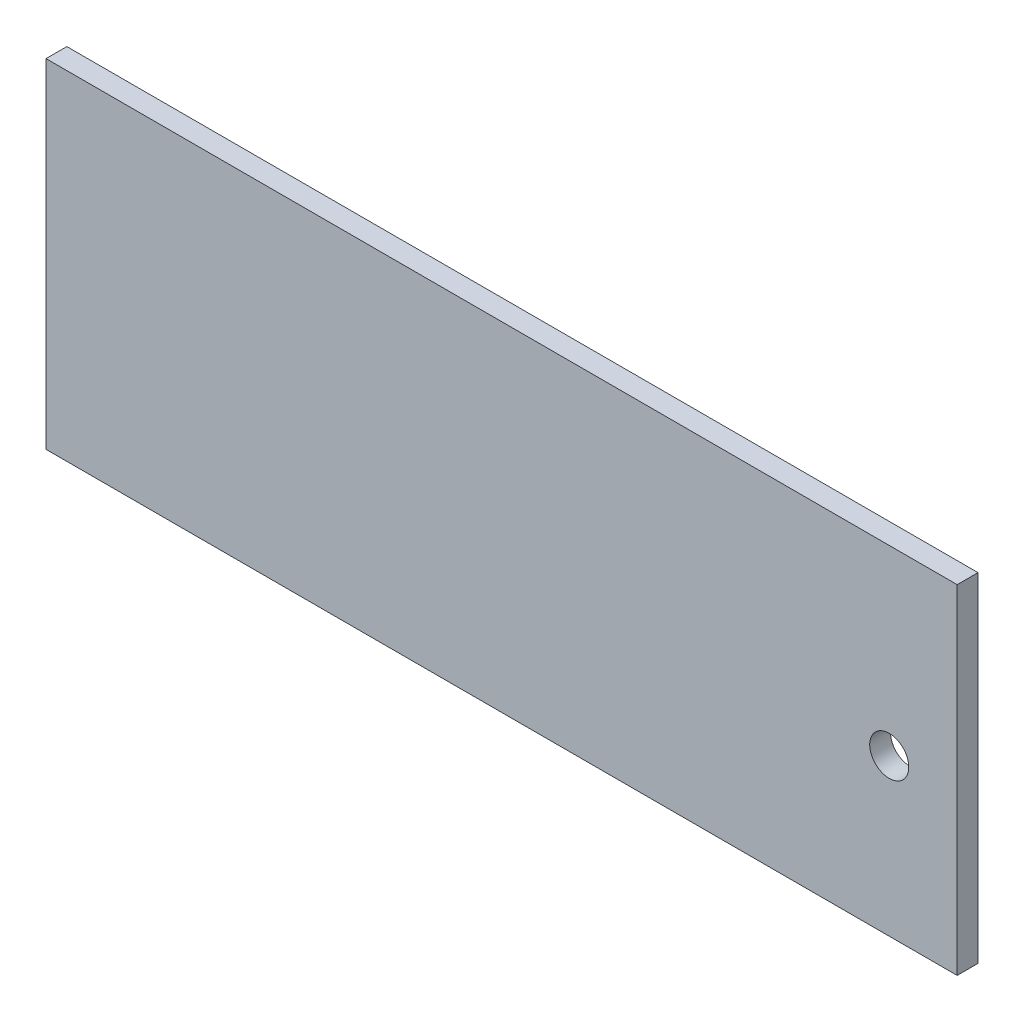
from build123d import *

# Parameters (mm, degrees)
SKETCH1_W           = 35
SKETCH1_H           = 13
SKETCH1_R           = 0.75
BOSS_EXTRUDE1_DEPTH = 0.8


with BuildPart() as part:
    # Sketch1 → Boss-Extrude1 (new body)
    with BuildSketch(Plane.XY):
        with Locations((17.5, 6.5)):
            Rectangle(SKETCH1_W, SKETCH1_H)
        with Locations((32.39, 6)):
            Circle(SKETCH1_R, mode=Mode.SUBTRACT)
    extrude(amount=BOSS_EXTRUDE1_DEPTH)


solid = part.part
